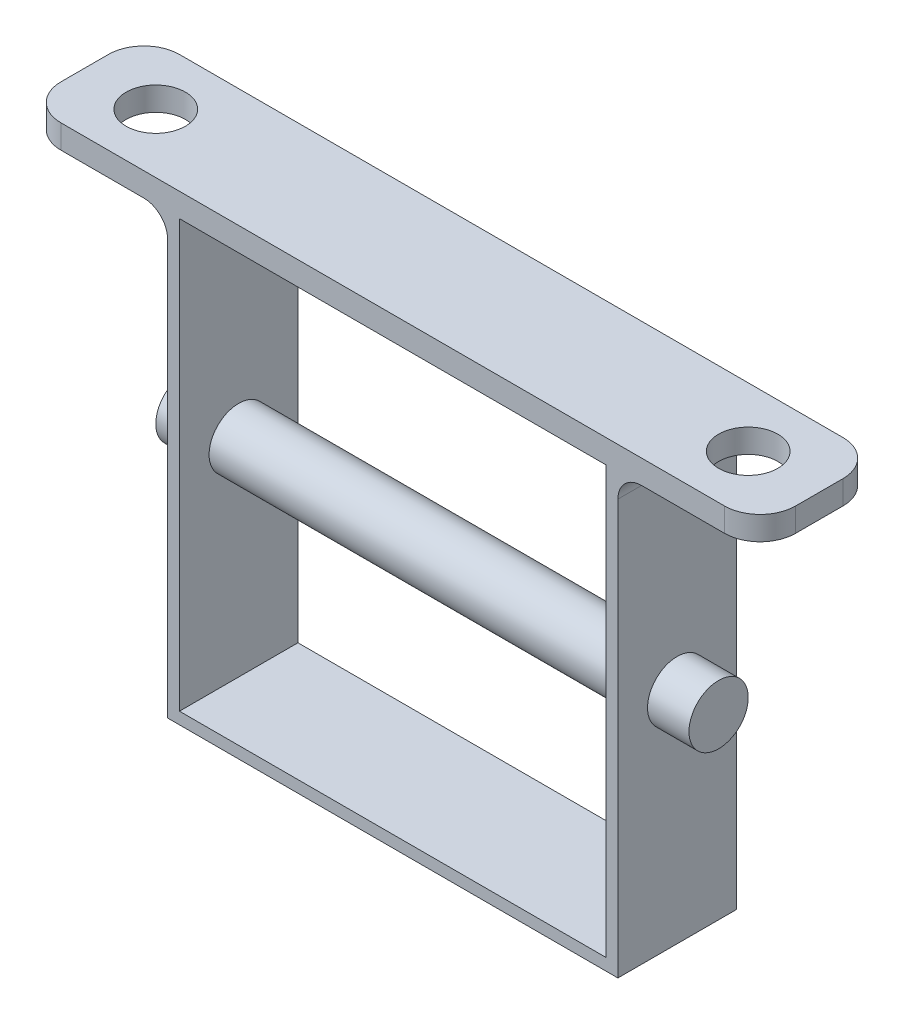
from build123d import *

# Parameters (mm, degrees)
SKETCH1_W           = 96.52
SKETCH1_H           = 96.52
SKETCH1_W_2         = 91.44
SKETCH1_H_2         = 91.44
BOSS_EXTRUDE1_DEPTH = 25.4
SKETCH3_W           = 157.48
SKETCH3_H           = 25.4
BOSS_EXTRUDE2_DEPTH = 2.54
FILLET1_R           = 5.08
SKETCH4_R           = 6.35
CUT_EXTRUDE2_DEPTH  = 161.02
FILLET2_R           = 7.62
SKETCH5_R           = 6.35
BOSS_EXTRUDE4_DEPTH = 57.15


with BuildPart() as part:
    # Sketch1 → Boss-Extrude1 (new body)
    with BuildSketch(Plane.XY):
        with Locations((48.26, -48.26)):
            Rectangle(SKETCH1_W, SKETCH1_H)
        with Locations((48.26, -48.26)):
            Rectangle(SKETCH1_W_2, SKETCH1_H_2, mode=Mode.SUBTRACT)
    extrude(amount=BOSS_EXTRUDE1_DEPTH)

    # Sketch3 → Boss-Extrude2 (add, symmetric)
    with BuildSketch(Plane(origin=(0, 0, 0), x_dir=(1, 0, 0), z_dir=(0, 1, 0))):
        with Locations((48.26, -12.7)):
            Rectangle(SKETCH3_W, SKETCH3_H)
    extrude(amount=BOSS_EXTRUDE2_DEPTH, both=True)

    # Fillet1
    fillet1_edges = [part.edges().sort_by_distance(p)[0] for p in [
        (0, -2.54, 12.7),
        (96.52, -2.54, 12.7),
    ]]
    fillet(fillet1_edges, radius=FILLET1_R)

    # Sketch4 → Cut-Extrude2 (cut, through all)
    with BuildSketch(Plane.XZ.offset(2.54)):
        with Locations(Location((111.76, 12.7, 0), (0, 0, 270))):
            Circle(SKETCH4_R)
        with Locations(Location((-15.24, 12.7, 0), (0, 0, 90))):
            Circle(SKETCH4_R)
    extrude(amount=-CUT_EXTRUDE2_DEPTH, mode=Mode.SUBTRACT)

    # Fillet2
    fillet2_edges = [part.edges().sort_by_distance(p)[0] for p in [
        (-30.48, 0, 25.4),
        (127, 0, 0),
        (-30.48, 0, 0),
        (127, 0, 25.4),
    ]]
    fillet(fillet2_edges, radius=FILLET2_R)

    # Sketch5 → Boss-Extrude4 (add, symmetric)
    with BuildSketch(Plane(origin=(48.26, 0, 0), x_dir=(0, 0, -1), z_dir=(1, 0, 0))):
        with Locations(Location((-12.7, -49.53, 0), (0, 0, 270))):
            Circle(SKETCH5_R)
    extrude(amount=BOSS_EXTRUDE4_DEPTH, both=True)


solid = part.part
